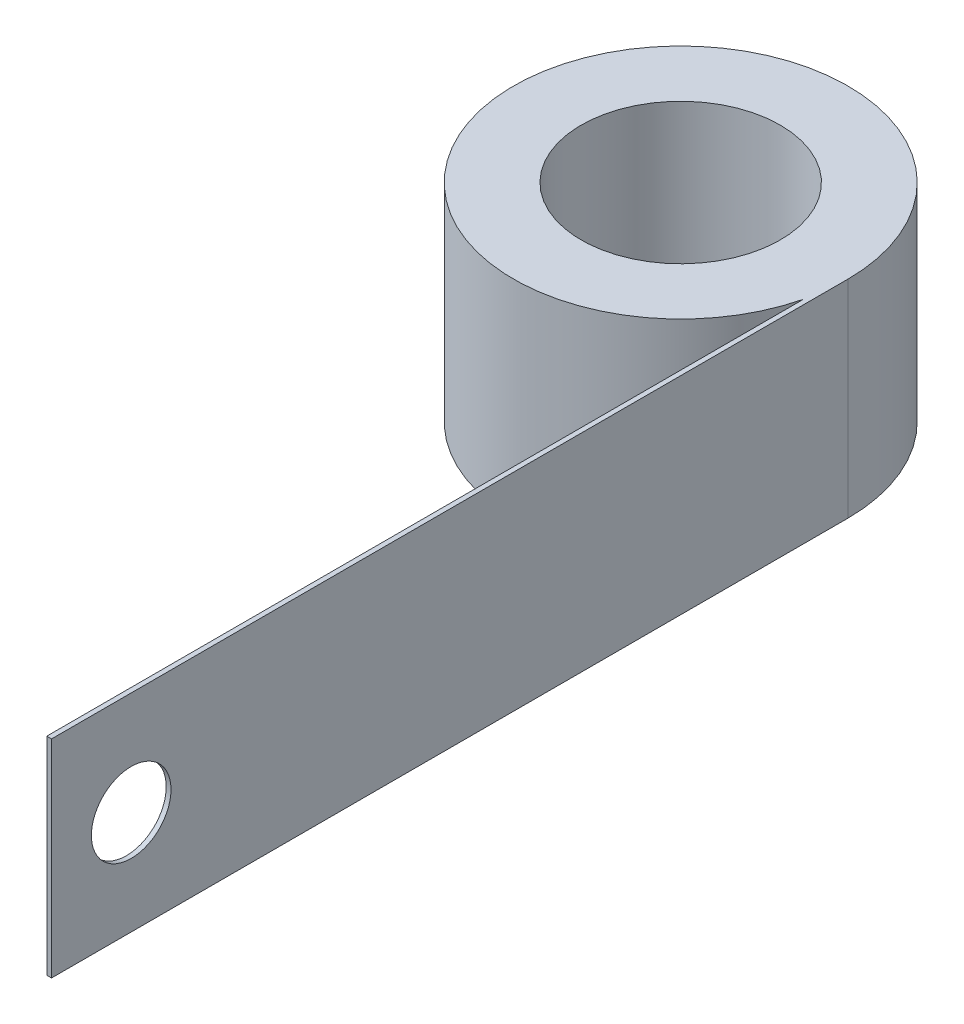
from build123d import *

# Parameters (mm, degrees)
SKETCH_1_R          = 10.5
SKETCH_1_R_2        = 6.25
EXTRUDE_1_DEPTH     = 13
SKETCH_2_W          = 0.3
SKETCH_2_H          = 50
EXTRUDE_2_DEPTH     = 13
SKETCH_3_R          = 2.5
CUT_EXTRUDE_1_DEPTH = 56.767373974


with BuildPart() as part:
    # 草图1 → 凸台-拉伸1 (new body)
    with BuildSketch(Plane(origin=(0, 0, 0), x_dir=(1, 0, 0), z_dir=(0, 1, 0))):
        with Locations(Location((0, 0, 0), (0, 0, 90))):
            Circle(SKETCH_1_R)
        with Locations(Location((0, 0, 0), (0, 0, 90))):
            Circle(SKETCH_1_R_2, mode=Mode.SUBTRACT)
    extrude(amount=EXTRUDE_1_DEPTH)

    # 草图2 → 凸台-拉伸2 (add)
    with BuildSketch(Plane(origin=(0, 13, 0), x_dir=(1, 0, 0), z_dir=(0, 1, 0))):
        with Locations((10.35, -25)):
            Rectangle(SKETCH_2_W, SKETCH_2_H)
    extrude(amount=-EXTRUDE_2_DEPTH)

    # 草图3 → 切除-拉伸1 (cut, through all)
    with BuildSketch(Plane(origin=(10.5, 0, 0), x_dir=(0, 0, -1), z_dir=(1, 0, 0))):
        with Locations((-45, 6.5)):
            Circle(SKETCH_3_R)
    extrude(amount=-CUT_EXTRUDE_1_DEPTH, mode=Mode.SUBTRACT)


solid = part.part
